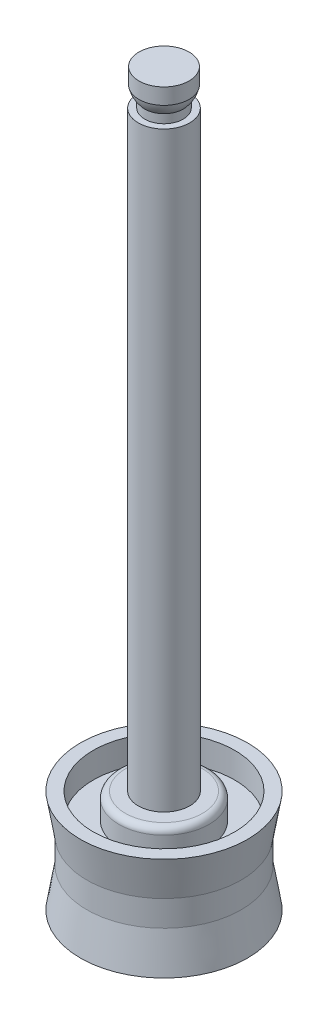
from build123d import *

# Parameters (mm, degrees)
SKETCH_1_R          = 6.5
EXTRUDE_1_DEPTH     = 8
SKETCH_2_R          = 2
EXTRUDE_2_DEPTH     = 46
SKETCH_6_R          = 5.5
SKETCH_6_R_2        = 3.5
CUT_EXTRUDE_1_DEPTH = 2
CUT_EXTRUDE_START   = -2
SKETCH_7_R          = 5.5
SKETCH_7_R_2        = 3.5
CUT_EXTRUDE_2_DEPTH = 2
FILLET_2_R          = 0.5


with BuildPart() as part:
    # 草图1 → 凸台-拉伸1 (new body)
    with BuildSketch(Plane(origin=(0, 0, 0), x_dir=(1, 0, 0), z_dir=(0, 1, 0))):
        with Locations(Location((0, 0, 0), (0, 0, 270))):
            Circle(SKETCH_1_R)
    extrude(amount=EXTRUDE_1_DEPTH)

    # 草图2 → 凸台-拉伸2 (add)
    with BuildSketch(Plane(origin=(0, 8, 0), x_dir=(1, 0, 0), z_dir=(0, 1, 0))):
        with Locations(Location((0, 0, 0), (0, 0, 270))):
            Circle(SKETCH_2_R)
    extrude(amount=EXTRUDE_2_DEPTH)

    # 草图4 → 旋转1 (revolve)
    with BuildSketch(Plane.XY):
        with BuildLine():
            Line((0, 54), (0, 56))
            Line((0, 56), (0, 56.8))
            Line((0, 56.8), (1.95, 56.8))
            Line((1.95, 56.8), (1.95, 55.555590279))
            ThreePointArc((1.95, 55.555590279), (1.780042303, 55.088161527), (1.5, 54.677124344))
            Line((1.5, 54.677124344), (1.5, 54))
            Line((1.5, 54), (0, 54))
        make_face()
    revolve(axis=Axis((0, 54, 0), (0, 1, 0)))

    # 草图5 → 切除-旋转1 (revolve, cut)
    with BuildSketch(Plane.XY, mode=Mode.PRIVATE) as cut_revolve_1_sk:
        Polygon((-6.5, 8), (-6.5, 5), (-6.5, 3), (-6.5, 0), (-6, 3), (-6, 5), align=None)
    revolve(cut_revolve_1_sk.sketch.rotate(Axis((0, 0, 0), (0, 1, 0)), 270), axis=Axis((0, 0, 0), (0, 1, 0)), mode=Mode.SUBTRACT)

    # 草图6 → 切除-拉伸1 (cut)
    with BuildSketch(Plane.XZ):
        with Locations(Location((0, 0, 0), (0, 0, 270))):
            Circle(SKETCH_6_R)
        with Locations(Location((0, 0, 0), (0, 0, 270))):
            Circle(SKETCH_6_R_2, mode=Mode.SUBTRACT)
    extrude(amount=-CUT_EXTRUDE_1_DEPTH, mode=Mode.SUBTRACT)

    # 草图7 → 切除-拉伸2 (cut)
    with BuildSketch(Plane(origin=(0, 8, 0), x_dir=(1, 0, 0), z_dir=(0, 1, 0)).offset(CUT_EXTRUDE_START)):
        with Locations(Location((0, 0, 0), (0, 0, 90))):
            Circle(SKETCH_7_R)
        with Locations(Location((0, 0, 0), (0, 0, 90))):
            Circle(SKETCH_7_R_2, mode=Mode.SUBTRACT)
    extrude(amount=CUT_EXTRUDE_2_DEPTH, mode=Mode.SUBTRACT)

    # 圆角2
    fillet_2_edges = [part.edges().sort_by_distance(p)[0] for p in [
        (0, 0, 3.5),
        (0, 8, 3.5),
    ]]
    fillet(fillet_2_edges, radius=FILLET_2_R)


solid = part.part
